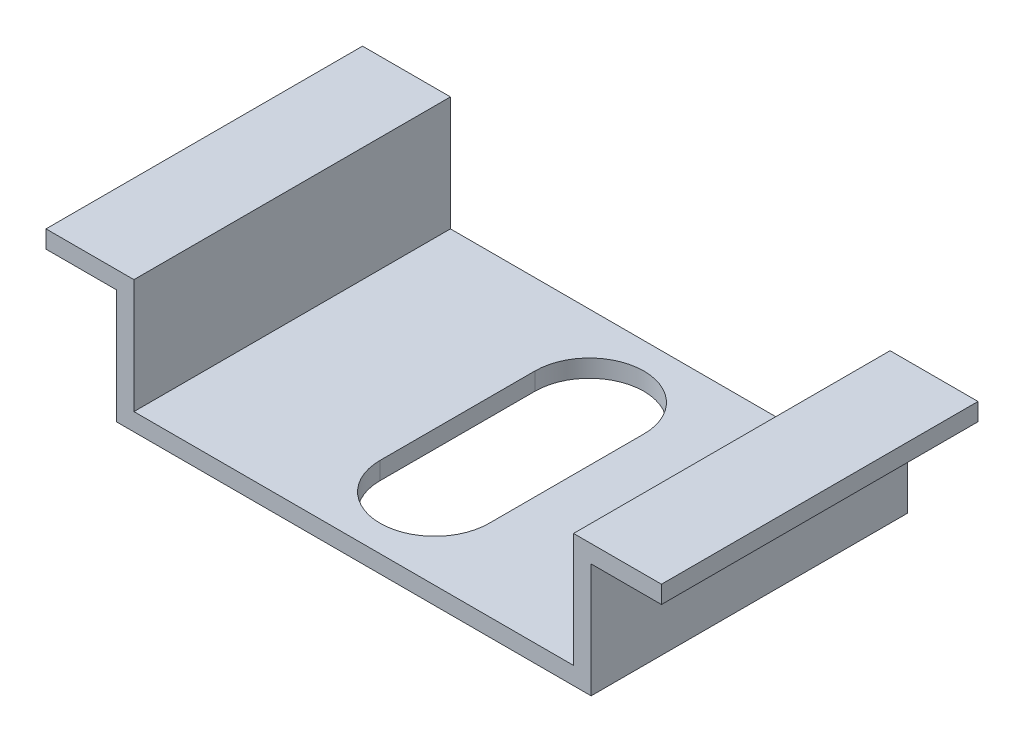
from build123d import *

# Parameters (mm, degrees)
SKETCH1_W           = 35
SKETCH1_H           = 175
BOSS_EXTRUDE1_DEPTH = 7.5
SKETCH2_W           = 25
SKETCH2_H           = 6.5
CUT_EXTRUDE1_DEPTH  = 179.623206779
CUT_EXTRUDE2_DEPTH  = 179.623206779
SKETCH4_W           = 4
SKETCH4_H           = 6.5
CUT_EXTRUDE3_DEPTH  = 179.623206779
SKETCH5_W           = 4
SKETCH5_H           = 6.5
CUT_EXTRUDE4_DEPTH  = 179.623206779
CUT_EXTRUDE5_DEPTH  = 179.623206779
CUT_EXTRUDE6_DEPTH  = 179.584013842
CUT_EXTRUDE7_DEPTH  = 179.584013842
CUT_EXTRUDE8_DEPTH  = 179.584013842
CUT_EXTRUDE9_DEPTH  = 179.584013842
CUT_EXTRUDE10_DEPTH = 179.584013842
CUT_EXTRUDE11_DEPTH = 179.623206779
SKETCH13_W          = 54.072725276
SKETCH13_H          = 30.837150003
CUT_EXTRUDE12_DEPTH = 15
SKETCH14_W          = 49.0024185
SKETCH14_H          = 27.053522809
CUT_EXTRUDE13_DEPTH = 142


with BuildPart() as part:
    # Sketch1 → Boss-Extrude1 (new body)
    with BuildSketch(Plane(origin=(0, 0, 0), x_dir=(1, 0, 0), z_dir=(0, 1, 0))):
        with Locations((-17.5, -87.5)):
            Rectangle(SKETCH1_W, SKETCH1_H)
    extrude(amount=-BOSS_EXTRUDE1_DEPTH)

    # Sketch2 → Cut-Extrude1 (cut, through all)
    with BuildSketch(Plane(origin=(0, 0, 0), x_dir=(-1, 0, 0), z_dir=(0, 0, -1))):
        with Locations((17.5, -3.25)):
            Rectangle(SKETCH2_W, SKETCH2_H)
    extrude(amount=-CUT_EXTRUDE1_DEPTH, mode=Mode.SUBTRACT)

    # Sketch3 → Cut-Extrude2 (cut, through all)
    with BuildSketch(Plane.XZ.offset(7.5)):
        with BuildLine():
            Line((-20.6, 0), (-14.4, 0))
            Line((-14.4, 0), (-14.4, 3.4))
            ThreePointArc((-14.4, 3.4), (-17.5, 6.5), (-20.6, 3.4))
            Line((-20.6, 3.4), (-20.6, 0))
        make_face()
    extrude(amount=-CUT_EXTRUDE2_DEPTH, mode=Mode.SUBTRACT)

    # Sketch4 → Cut-Extrude3 (cut, through all)
    with BuildSketch(Plane(origin=(0, 0, 0), x_dir=(-1, 0, 0), z_dir=(0, 0, -1))):
        with Locations((33, -4.25)):
            Rectangle(SKETCH4_W, SKETCH4_H)
    extrude(amount=-CUT_EXTRUDE3_DEPTH, mode=Mode.SUBTRACT)

    # Sketch5 → Cut-Extrude4 (cut, through all)
    with BuildSketch(Plane(origin=(0, 0, 0), x_dir=(-1, 0, 0), z_dir=(0, 0, -1))):
        with Locations((2, -4.25)):
            Rectangle(SKETCH5_W, SKETCH5_H)
    extrude(amount=-CUT_EXTRUDE4_DEPTH, mode=Mode.SUBTRACT)

    # Sketch6 → Cut-Extrude5 (cut, through all)
    with BuildSketch(Plane.XZ.offset(7.5)):
        with BuildLine():
            Line((-14.4, 175), (-20.6, 175))
            Line((-20.6, 175), (-20.6, 169.6))
            ThreePointArc((-20.6, 169.6), (-17.5, 166.5), (-14.4, 169.6))
            Line((-14.4, 169.6), (-14.4, 175))
        make_face()
    extrude(amount=-CUT_EXTRUDE5_DEPTH, mode=Mode.SUBTRACT)

    # Sketch7 → Cut-Extrude6 (cut, through all)
    with BuildSketch(Plane(origin=(0, -6.5, 0), x_dir=(-1, 0, 0), z_dir=(0, 1, 0))):
        with BuildLine():
            Line((14.4, 103.4), (14.4, 94.6))
            ThreePointArc((14.4, 94.6), (17.5, 91.5), (20.6, 94.6))
            Line((20.6, 94.6), (20.6, 103.4))
            ThreePointArc((20.6, 103.4), (17.5, 106.5), (14.4, 103.4))
        make_face()
    extrude(amount=-CUT_EXTRUDE6_DEPTH, mode=Mode.SUBTRACT)

    # Sketch8 → Cut-Extrude7 (cut, through all)
    with BuildSketch(Plane(origin=(0, -6.5, 0), x_dir=(-1, 0, 0), z_dir=(0, 1, 0))):
        with BuildLine():
            Line((14.4, 78.4), (14.4, 69.6))
            ThreePointArc((14.4, 69.6), (17.5, 66.5), (20.6, 69.6))
            Line((20.6, 69.6), (20.6, 78.4))
            ThreePointArc((20.6, 78.4), (17.5, 81.5), (14.4, 78.4))
        make_face()
    extrude(amount=-CUT_EXTRUDE7_DEPTH, mode=Mode.SUBTRACT)

    # Sketch9 → Cut-Extrude8 (cut, through all)
    with BuildSketch(Plane(origin=(0, -6.5, 0), x_dir=(-1, 0, 0), z_dir=(0, 1, 0))):
        with BuildLine():
            Line((14.4, 28.4), (14.4, 19.6))
            ThreePointArc((14.4, 19.6), (17.5, 16.5), (20.6, 19.6))
            Line((20.6, 19.6), (20.6, 28.4))
            ThreePointArc((20.6, 28.4), (17.5, 31.5), (14.4, 28.4))
        make_face()
    extrude(amount=-CUT_EXTRUDE8_DEPTH, mode=Mode.SUBTRACT)

    # Sketch10 → Cut-Extrude9 (cut, through all)
    with BuildSketch(Plane(origin=(0, -6.5, 0), x_dir=(-1, 0, 0), z_dir=(0, 1, 0))):
        with BuildLine():
            Line((14.4, 153.4), (14.4, 144.6))
            ThreePointArc((14.4, 144.6), (17.5, 141.5), (20.6, 144.6))
            Line((20.6, 144.6), (20.6, 153.4))
            ThreePointArc((20.6, 153.4), (17.5, 156.5), (14.4, 153.4))
        make_face()
    extrude(amount=-CUT_EXTRUDE9_DEPTH, mode=Mode.SUBTRACT)

    # Sketch11 → Cut-Extrude10 (cut, through all)
    with BuildSketch(Plane(origin=(0, -6.5, 0), x_dir=(-1, 0, 0), z_dir=(0, 1, 0))):
        with BuildLine():
            Line((14.4, 128.4), (14.4, 119.6))
            ThreePointArc((14.4, 119.6), (17.5, 116.5), (20.6, 119.6))
            Line((20.6, 119.6), (20.6, 128.4))
            ThreePointArc((20.6, 128.4), (17.5, 131.5), (14.4, 128.4))
        make_face()
    extrude(amount=-CUT_EXTRUDE10_DEPTH, mode=Mode.SUBTRACT)

    # Sketch12 → Cut-Extrude11 (cut, through all)
    with BuildSketch(Plane.XZ.offset(7.5)):
        with BuildLine():
            Line((-20.6, 53.4), (-20.6, 44.6))
            ThreePointArc((-20.6, 44.6), (-17.5, 41.5), (-14.4, 44.6))
            Line((-14.4, 44.6), (-14.4, 53.4))
            ThreePointArc((-14.4, 53.4), (-17.5, 56.5), (-20.6, 53.4))
        make_face()
    extrude(amount=-CUT_EXTRUDE11_DEPTH, mode=Mode.SUBTRACT)

    # Sketch13 → Cut-Extrude12 (cut)
    with BuildSketch(Plane(origin=(0, 0, 0), x_dir=(-1, 0, 0), z_dir=(0, 0, -1))):
        with Locations((12.505255608, -4.443731482)):
            Rectangle(SKETCH13_W, SKETCH13_H)
    extrude(amount=-CUT_EXTRUDE12_DEPTH, mode=Mode.SUBTRACT)

    # Sketch14 → Cut-Extrude13 (cut)
    with BuildSketch(Plane.XY.offset(175)):
        with Locations((-15.887003793, 1.102839907)):
            Rectangle(SKETCH14_W, SKETCH14_H)
    extrude(amount=-CUT_EXTRUDE13_DEPTH, mode=Mode.SUBTRACT)


solid = part.part
